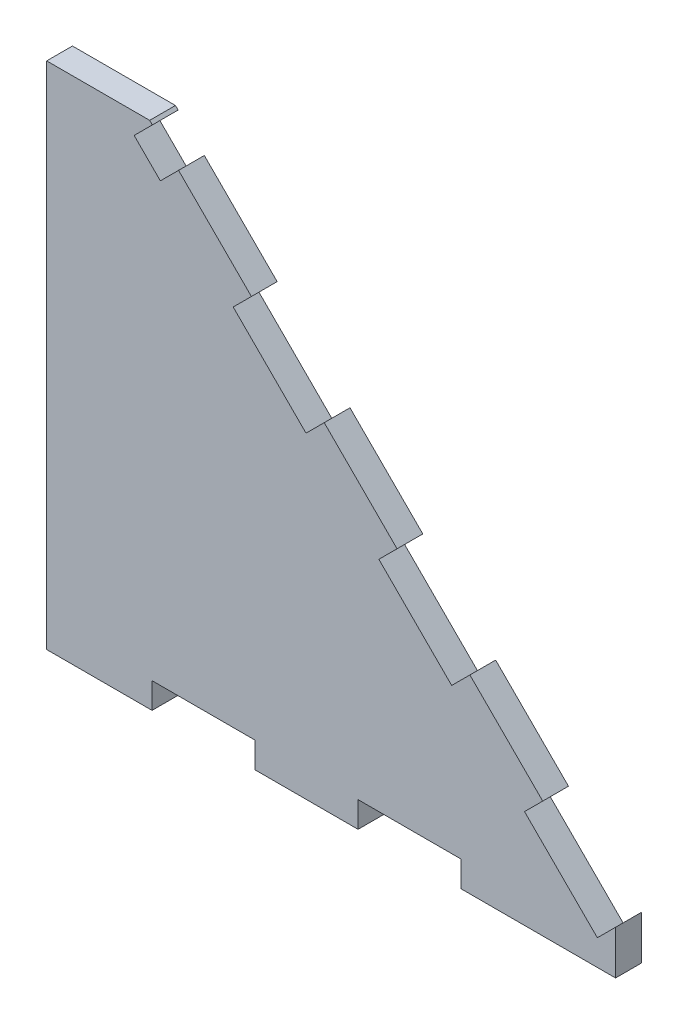
from build123d import *

# Parameters (mm, degrees)
BOSS_EXTRUDE1_DEPTH     = 3.175
CUT_EXTRUDE1_DEPTH      = 95.24196383
CUT_EXTRUDE1_DEPTH_BACK = 95.24196383
SKETCH3_W               = 12.7
SKETCH3_H               = 3.175


with BuildPart() as part:
    # Sketch2 → Boss-Extrude1 (new body)
    with BuildSketch(Plane.XY):
        Polygon((13.027299887, 62.53449296), (12.7, 62.861792847), (0, 62.861792847), (0, 0), (70.141728817, 0), (70.141728817, 5.42006403), (67.896664787, 3.175), (58.916408666, 12.155256121), (61.161472696, 14.400320151), (52.181216575, 23.380576272), (49.936152545, 21.135512242), (40.955896424, 30.115768363), (43.200960454, 32.360832393), (34.220704333, 41.341088515), (31.975640303, 39.096024484), (22.995384182, 48.076280605), (25.240448212, 50.321344636), (16.260192091, 59.301600757), (14.015128061, 57.056536726), (10.782235857, 60.28942893), align=None)
    extrude(amount=BOSS_EXTRUDE1_DEPTH)

    # Sketch3 → Cut-Extrude1 (cut, two sides: drawn at the far end of the back side and taken through both)
    with BuildSketch(Plane.XY.offset(3.175).offset(-CUT_EXTRUDE1_DEPTH_BACK)):
        with Locations((44.741728817, 1.5875)):
            Rectangle(SKETCH3_W, SKETCH3_H)
        with Locations((19.341728817, 1.5875)):
            Rectangle(SKETCH3_W, SKETCH3_H)
    extrude(amount=CUT_EXTRUDE1_DEPTH + CUT_EXTRUDE1_DEPTH_BACK, mode=Mode.SUBTRACT)


solid = part.part
